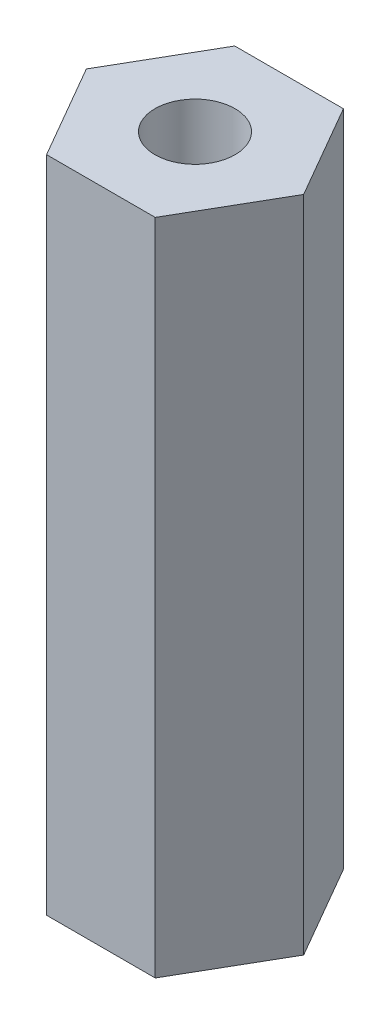
from build123d import *

# Parameters (mm, degrees)
SKETCH1_R           = 4.25
BOSS_EXTRUDE1_DEPTH = 70


with BuildPart() as part:
    # Sketch1 → Boss-Extrude1 (new body)
    with BuildSketch(Plane(origin=(0, 0, 0), x_dir=(1, 0, 0), z_dir=(0, 1, 0))):
        Polygon((11.547005384, 0), (5.773502692, 10), (-5.773502692, 10), (-11.547005384, 0), (-5.773502692, -10), (5.773502692, -10), align=None)
        with Locations(Location((0, 0, 0), (0, 0, 270))):
            Circle(SKETCH1_R, mode=Mode.SUBTRACT)
    extrude(amount=-BOSS_EXTRUDE1_DEPTH)


solid = part.part
